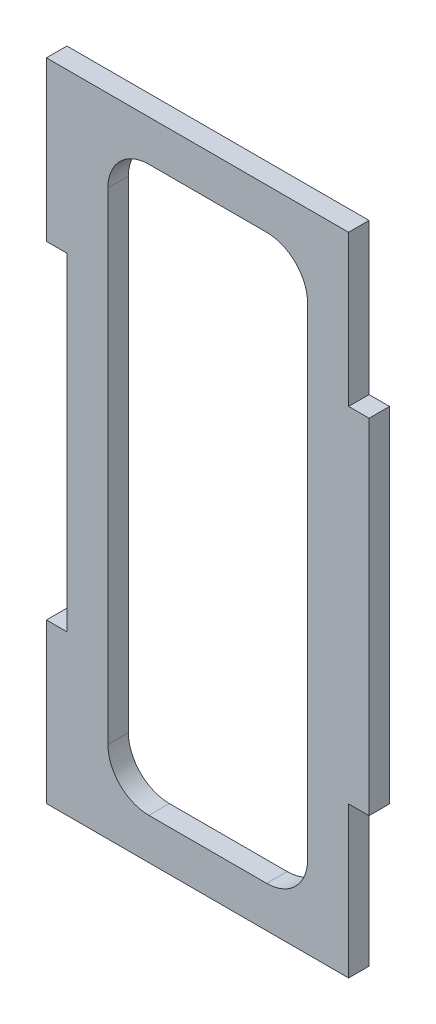
from build123d import *

# Parameters (mm, degrees)
SKETCH1_W           = 100
SKETCH1_H           = 200.1518
BOSS_EXTRUDE1_DEPTH = 6.35
SKETCH2_W           = 6.35
SKETCH2_H           = 50.8
SKETCH2_H_2         = 49.2759
CUT_EXTRUDE1_DEPTH  = 6.35
SKETCH3_W           = 61.9
SKETCH3_H           = 174.7518
CUT_EXTRUDE2_DEPTH  = 6.35
FILLET1_R           = 12.7
SKETCH6_W           = 6.35
SKETCH6_H           = 6.35
BOSS_EXTRUDE2_DEPTH = 2.54
SKETCH7_W           = 6.35
SKETCH7_H           = 6.35
BOSS_EXTRUDE3_DEPTH = 2.54


with BuildPart() as part:
    # Sketch1 → Boss-Extrude1 (new body)
    with BuildSketch(Plane.XY):
        with Locations((0, -50.0759)):
            Rectangle(SKETCH1_W, SKETCH1_H)
    extrude(amount=BOSS_EXTRUDE1_DEPTH)

    # Sketch2 → Cut-Extrude1 (cut)
    with BuildSketch(Plane.XY.offset(6.35)):
        with Locations((-46.825, -24.6759)):
            Rectangle(SKETCH2_W, SKETCH2_H)
        with Locations((-46.825, -75.4759)):
            Rectangle(SKETCH2_W, SKETCH2_H)
        with Locations((46.825, 25.36205)):
            Rectangle(SKETCH2_W, SKETCH2_H_2)
        with Locations((46.825, -125.51385)):
            Rectangle(SKETCH2_W, SKETCH2_H_2)
    extrude(amount=-CUT_EXTRUDE1_DEPTH, mode=Mode.SUBTRACT)

    # Sketch3 → Cut-Extrude2 (cut)
    with BuildSketch(Plane.XY.offset(6.35)):
        with Locations((0, -50.0759)):
            Rectangle(SKETCH3_W, SKETCH3_H)
    extrude(amount=-CUT_EXTRUDE2_DEPTH, mode=Mode.SUBTRACT)

    # Fillet1
    fillet1_edges = [part.edges().sort_by_distance(p)[0] for p in [
        (-30.95, -137.4518, 3.175),
        (-30.95, 37.3, 3.175),
        (30.95, 37.3, 3.175),
        (30.95, -137.4518, 3.175),
    ]]
    fillet(fillet1_edges, radius=FILLET1_R)

    # Sketch6 → Boss-Extrude2 (add)
    with BuildSketch(Plane(origin=(0, 0.7241, 0), x_dir=(1, 0, 0), z_dir=(0, 1, 0))):
        with Locations((46.825, -3.175)):
            Rectangle(SKETCH6_W, SKETCH6_H)
    extrude(amount=BOSS_EXTRUDE2_DEPTH)

    # Sketch7 → Boss-Extrude3 (add)
    with BuildSketch(Plane.XZ.offset(100.8759)):
        with Locations((46.825, 3.175)):
            Rectangle(SKETCH7_W, SKETCH7_H)
    extrude(amount=BOSS_EXTRUDE3_DEPTH)


solid = part.part
